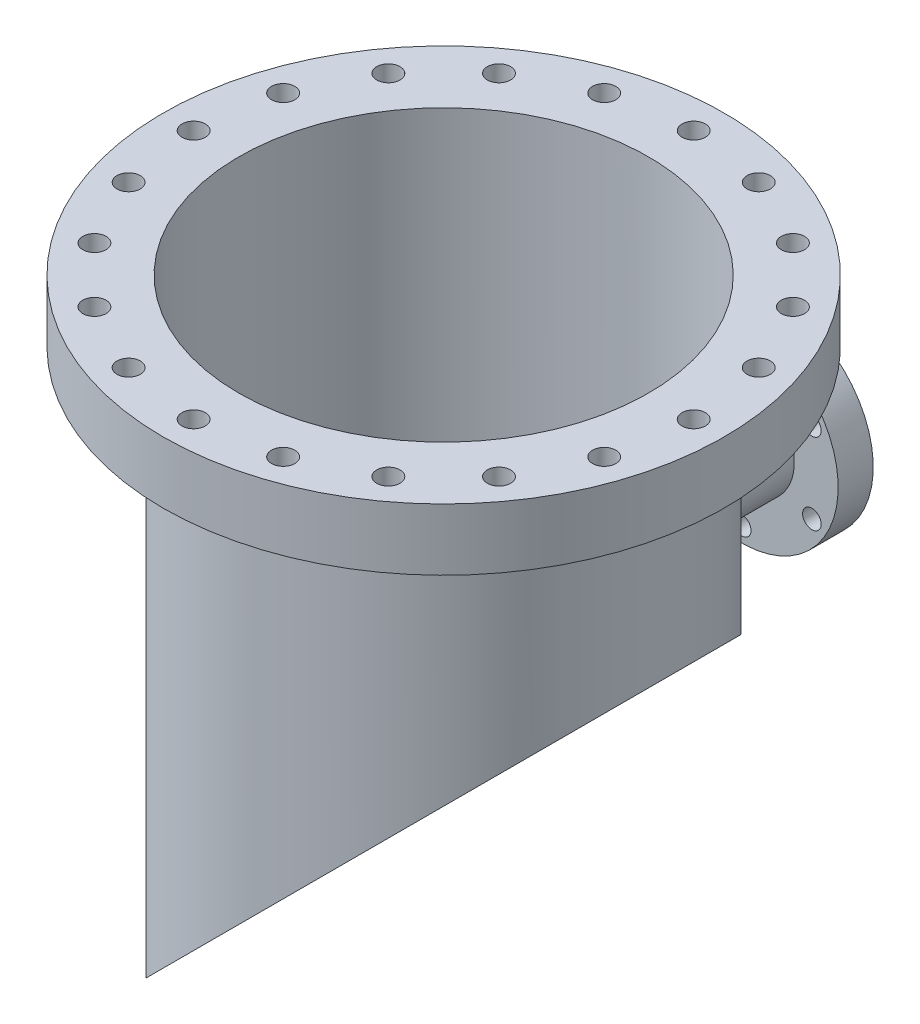
from build123d import *

# Parameters (mm, degrees)
SKETCH1_R                      = 76.2
SKETCH1_R_2                    = 74.168
EXTRUDE_THIN1_DEPTH            = 110.236
CUT_EXTRUDE1_DEPTH             = 155.158540782
CUT_EXTRUDE1_DEPTH_BACK        = 155.158540782
SKETCH12_R                     = 101.6
EXTRUDE1_DEPTH                 = 22.352
SKETCH14_R                     = 74.168
CUT_EXTRUDE2_DEPTH             = 264.159690652
SKETCH15_R                     = 4.2164
CUT_EXTRUDE4_DEPTH             = 22.352
CIRPATTERN1_COUNT              = 20
EXTRUDE4_REACH                 = 273.569
EXTRUDE4_END_RADIUS            = 76.2
SKETCH24_R                     = 19.05
SKETCH25_R                     = 34.925
EXTRUDE5_DEPTH                 = 12.7
CUT_EXTRUDE7_REACH             = 273.569
CUT_EXTRUDE7_END_RADIUS        = 74.168
SKETCH26_R                     = 17.399
CUT_EXTRUDE7_DIRECTION_2_DEPTH = 12.7
SKETCH27_R                     = 3.3655
CUT_EXTRUDE9_DEPTH             = 12.7
CIRPATTERN3_COUNT              = 6


with BuildPart() as part:
    # Sketch1 → Extrude-Thin1 (new, symmetric)
    with BuildSketch(Plane(origin=(0, 0, 0), x_dir=(1, 0, 0), z_dir=(0, 1, 0))):
        Circle(SKETCH1_R)
        Circle(SKETCH1_R_2, mode=Mode.SUBTRACT)
    extrude(amount=EXTRUDE_THIN1_DEPTH, both=True)

    # Sketch2 → Cut-Extrude1 (cut, two sides: drawn at the far end of the back side and taken through both)
    with BuildSketch(Plane.XY.offset(-CUT_EXTRUDE1_DEPTH_BACK)):
        Polygon((-76.2, -110.236), (76.2, 42.164), (76.2, -110.236), align=None)
    extrude(amount=CUT_EXTRUDE1_DEPTH + CUT_EXTRUDE1_DEPTH_BACK, mode=Mode.SUBTRACT)

    # Sketch12 → Extrude1 (add)
    with BuildSketch(Plane(origin=(0, 110.236, 0), x_dir=(-1, 0, 0), z_dir=(0, 1, 0))):
        with Locations(Location((0, 0, 0), (0, 0, 90))):
            Circle(SKETCH12_R)
    extrude(amount=EXTRUDE1_DEPTH)

    # Sketch14 → Cut-Extrude2 (cut, through all)
    with BuildSketch(Plane(origin=(0, 110.236, 0), x_dir=(-1, 0, 0), z_dir=(0, 1, 0))):
        with Locations(Location((0, 0, 0), (0, 0, 90))):
            Circle(SKETCH14_R)
    extrude(amount=CUT_EXTRUDE2_DEPTH, mode=Mode.SUBTRACT)

    # Sketch15 → Cut-Extrude4 (cut)
    with BuildSketch(Plane(origin=(0, 110.236, 0), x_dir=(-1, 0, 0), z_dir=(0, 1, 0))):
        with Locations(Location((0, 90.551, 0), (0, 0, 90))):
            Circle(SKETCH15_R)
    cut_extrude4 = extrude(amount=CUT_EXTRUDE4_DEPTH, mode=Mode.SUBTRACT)

    # CirPattern1: Cut-Extrude4 ×20 about axis
    cirpattern1_axis = Axis((0, 0, 0), (0, 1, 0))
    for i in range(1, CIRPATTERN1_COUNT):
        add(cut_extrude4.rotate(cirpattern1_axis, i * 360 / CIRPATTERN1_COUNT), mode=Mode.SUBTRACT)

    # Extrude4: up to this cylinder (the profile starts outside it)
    extrude4_end = Plane(origin=(0, 29.464, 0), z_dir=(0, 1, 0)) * Cylinder(EXTRUDE4_END_RADIUS, 700.538, mode=Mode.PRIVATE)
    # Sketch24 → Extrude4 (add, up to the surface)
    with BuildSketch(Plane(origin=(0, 29.464, -107.95), x_dir=(-1, 0, 0), z_dir=(0, 0, -1)), mode=Mode.PRIVATE) as extrude4_sk1:
        Circle(SKETCH24_R)
    extrude4_tool1 = extrude(extrude4_sk1.sketch, amount=-EXTRUDE4_REACH, mode=Mode.PRIVATE) - extrude4_end
    add(extrude4_tool1.solids().sort_by_distance((0, 29.464, -107.95))[0])

    # Sketch25 → Extrude5 (add)
    with BuildSketch(Plane(origin=(0, 29.464, -107.95), x_dir=(-1, 0, 0), z_dir=(0, 0, -1))):
        Circle(SKETCH25_R)
    extrude(amount=EXTRUDE5_DEPTH)

    # Cut-Extrude7: up to this cylinder (the profile starts outside it)
    cut_extrude7_end = Plane(origin=(0, 29.464, 0), z_dir=(0, 1, 0)) * Cylinder(CUT_EXTRUDE7_END_RADIUS, 696.474, mode=Mode.PRIVATE)
    # Sketch26 → Cut-Extrude7 (cut, up to the surface)
    with BuildSketch(Plane(origin=(0, 29.464, -107.95), x_dir=(-1, 0, 0), z_dir=(0, 0, -1)), mode=Mode.PRIVATE) as cut_extrude7_sk1:
        with Locations(Location((0, 0, 0), (0, 0, 180))):
            Circle(SKETCH26_R)
    cut_extrude7_tool1 = extrude(cut_extrude7_sk1.sketch, amount=-CUT_EXTRUDE7_REACH, mode=Mode.PRIVATE) - cut_extrude7_end
    add(cut_extrude7_tool1.solids().sort_by_distance((0, 29.464, -107.95))[0], mode=Mode.SUBTRACT)

    # Sketch26 → Cut-Extrude7 direction 2 (cut)
    with BuildSketch(Plane(origin=(0, 29.464, -107.95), x_dir=(-1, 0, 0), z_dir=(0, 0, -1))):
        with Locations(Location((0, 0, 0), (0, 0, 180))):
            Circle(SKETCH26_R)
    extrude(amount=CUT_EXTRUDE7_DIRECTION_2_DEPTH, mode=Mode.SUBTRACT)

    # Sketch27 → Cut-Extrude9 (cut)
    with BuildSketch(Plane(origin=(0, 29.464, -107.95), x_dir=(-1, 0, 0), z_dir=(0, 0, -1))):
        with Locations((0, 29.337)):
            Circle(SKETCH27_R)
    cut_extrude9 = extrude(amount=CUT_EXTRUDE9_DEPTH, mode=Mode.SUBTRACT)

    # CirPattern3: Cut-Extrude9 ×6 about axis
    cirpattern3_axis = Axis((0, 29.464, 0), (0, 0, 1))
    for i in range(1, CIRPATTERN3_COUNT):
        add(cut_extrude9.rotate(cirpattern3_axis, i * 360 / CIRPATTERN3_COUNT), mode=Mode.SUBTRACT)


solid = part.part
